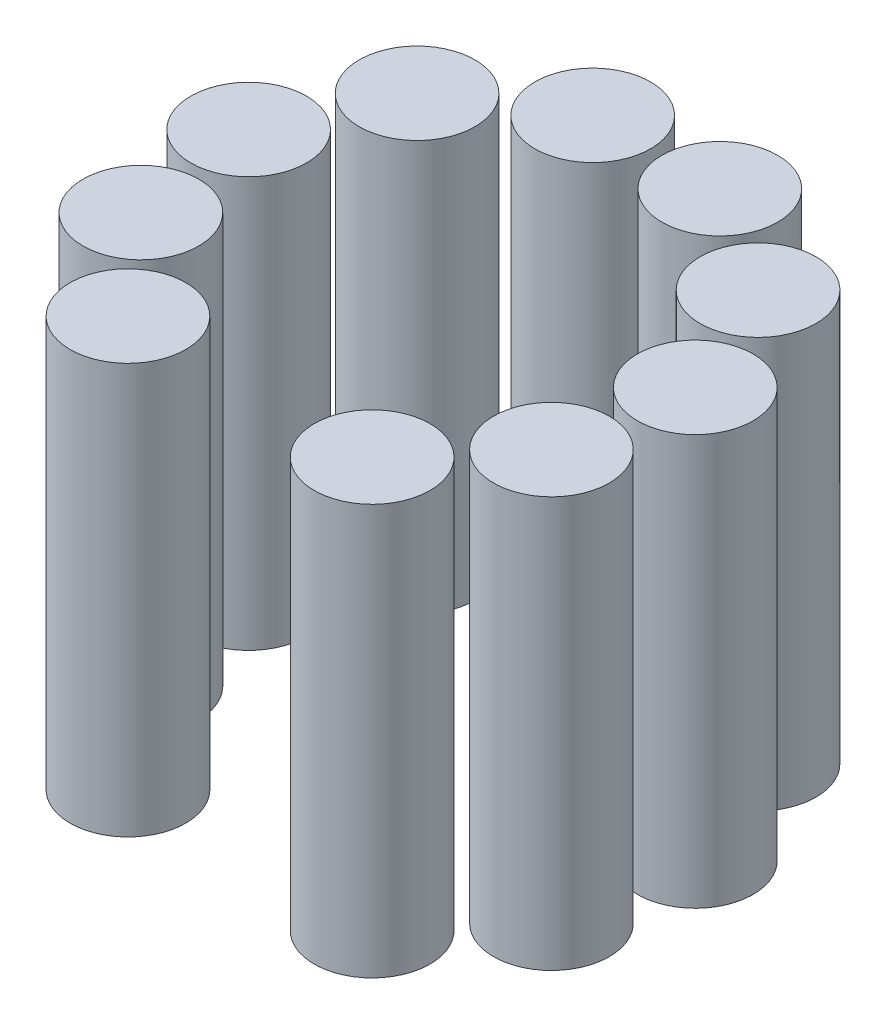
from build123d import *

# Parameters (mm, degrees)
SKETCH1_R              = 9.175
BOSS_EXTRUDE1_DEPTH    = 65
BOSS_EXTRUDE1_2_DEPTH  = 65
BOSS_EXTRUDE1_3_DEPTH  = 65
BOSS_EXTRUDE1_4_DEPTH  = 65
BOSS_EXTRUDE1_5_DEPTH  = 65
BOSS_EXTRUDE1_6_DEPTH  = 65
BOSS_EXTRUDE1_7_DEPTH  = 65
BOSS_EXTRUDE1_8_DEPTH  = 65
BOSS_EXTRUDE1_9_DEPTH  = 65
BOSS_EXTRUDE1_10_DEPTH = 65


with BuildPart() as part:
    # Sketch1 → Boss-Extrude1 (new body)
    with BuildSketch(Plane(origin=(0, 0, 0), x_dir=(1, 0, 0), z_dir=(0, 1, 0))):
        with Locations(Location((-10.069761866, 34.302512969, 0), (0, 0, 270))):
            Circle(SKETCH1_R)
    extrude(amount=BOSS_EXTRUDE1_DEPTH)


with BuildPart() as body_2:
    # Sketch1 → Boss-Extrude1 2 (new body)
    with BuildSketch(Plane(origin=(0, 0, 0), x_dir=(1, 0, 0), z_dir=(0, 1, 0))):
        with Locations(Location((-27.013589298, 23.416415038, 0), (0, 0, 270))):
            Circle(SKETCH1_R)
    extrude(amount=BOSS_EXTRUDE1_2_DEPTH)


with BuildPart() as body_3:
    # Sketch1 → Boss-Extrude1 3 (new body)
    with BuildSketch(Plane(origin=(0, 0, 0), x_dir=(1, 0, 0), z_dir=(0, 1, 0))):
        with Locations(Location((-35.384500255, 5.09898438, 0), (0, 0, 270))):
            Circle(SKETCH1_R)
    extrude(amount=BOSS_EXTRUDE1_3_DEPTH)


with BuildPart() as body_4:
    # Sketch1 → Boss-Extrude1 4 (new body)
    with BuildSketch(Plane(origin=(0, 0, 0), x_dir=(1, 0, 0), z_dir=(0, 1, 0))):
        with Locations(Location((-32.525938452, -14.836638023, 0), (0, 0, 270))):
            Circle(SKETCH1_R)
    extrude(amount=BOSS_EXTRUDE1_4_DEPTH)


with BuildPart() as body_5:
    # Sketch1 → Boss-Extrude1 5 (new body)
    with BuildSketch(Plane(origin=(0, 0, 0), x_dir=(1, 0, 0), z_dir=(0, 1, 0))):
        with Locations(Location((-19.345084764, -30.063768817, 0), (0, 0, 270))):
            Circle(SKETCH1_R)
    extrude(amount=BOSS_EXTRUDE1_5_DEPTH)


with BuildPart() as body_6:
    # Sketch1 → Boss-Extrude1 6 (new body)
    with BuildSketch(Plane(origin=(0, 0, 0), x_dir=(1, 0, 0), z_dir=(0, 1, 0))):
        with Locations(Location((19.345084764, -30.063768817, 0), (0, 0, 90))):
            Circle(SKETCH1_R)
    extrude(amount=BOSS_EXTRUDE1_6_DEPTH)


with BuildPart() as body_7:
    # Sketch1 → Boss-Extrude1 7 (new body)
    with BuildSketch(Plane(origin=(0, 0, 0), x_dir=(1, 0, 0), z_dir=(0, 1, 0))):
        with Locations(Location((32.525938452, -14.836638023, 0), (0, 0, 90))):
            Circle(SKETCH1_R)
    extrude(amount=BOSS_EXTRUDE1_7_DEPTH)


with BuildPart() as body_8:
    # Sketch1 → Boss-Extrude1 8 (new body)
    with BuildSketch(Plane(origin=(0, 0, 0), x_dir=(1, 0, 0), z_dir=(0, 1, 0))):
        with Locations(Location((35.384500255, 5.09898438, 0), (0, 0, 90))):
            Circle(SKETCH1_R)
    extrude(amount=BOSS_EXTRUDE1_8_DEPTH)


with BuildPart() as body_9:
    # Sketch1 → Boss-Extrude1 9 (new body)
    with BuildSketch(Plane(origin=(0, 0, 0), x_dir=(1, 0, 0), z_dir=(0, 1, 0))):
        with Locations(Location((27.013589298, 23.416415038, 0), (0, 0, 90))):
            Circle(SKETCH1_R)
    extrude(amount=BOSS_EXTRUDE1_9_DEPTH)


with BuildPart() as body_10:
    # Sketch1 → Boss-Extrude1 10 (new body)
    with BuildSketch(Plane(origin=(0, 0, 0), x_dir=(1, 0, 0), z_dir=(0, 1, 0))):
        with Locations(Location((10.069761866, 34.302512969, 0), (0, 0, 90))):
            Circle(SKETCH1_R)
    extrude(amount=BOSS_EXTRUDE1_10_DEPTH)


solid = Compound([part.part, body_2.part, body_3.part, body_4.part, body_5.part, body_6.part, body_7.part, body_8.part, body_9.part, body_10.part])
